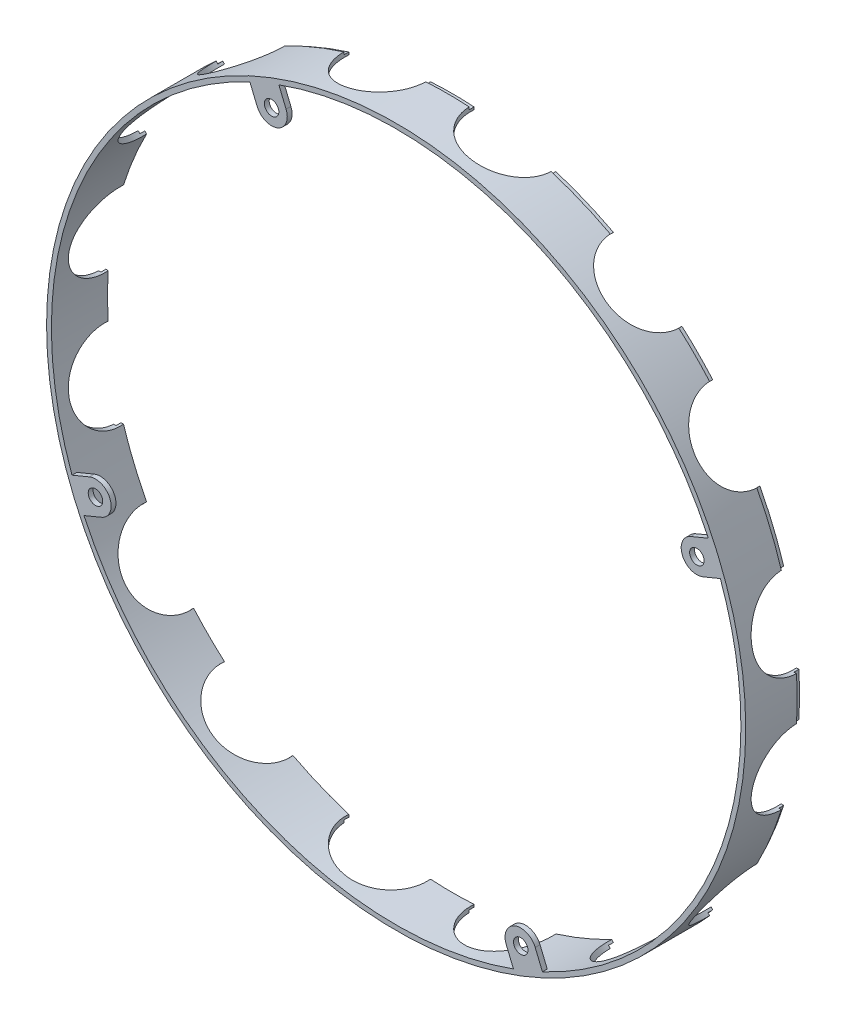
from build123d import *

# Parameters (mm, degrees)
SKIZZE4_R                       = 72.5
SKIZZE4_R_2                     = 72
BASE_RING_DEPTH                 = 9.65
SKIZZE6_R                       = 72
SKIZZE6_R_2                     = 71.5
INNER_RING_DEPTH                = 10.65
UPPER_START                     = 1
SKIZZE9_R                       = 72.5
SKIZZE9_R_2                     = 71.5
UPPER_RING_DEPTH                = 1
SKIZZE5_R                       = 8.5
SENSOR_CUT_DEPTH                = 104.082115326
SENSOR_ROTATION_COUNT           = 8
AUFSATZ_LINEAR_START            = 1
SKIZZE8_R                       = 1.5
AUFSATZ_LINEAR_AUSTRAGEN3_DEPTH = 1
KREISMUSTER2_COUNT              = 4


with BuildPart() as part:
    # Skizze4 → Base Ring (new body)
    with BuildSketch(Plane.XY):
        Circle(SKIZZE4_R)
        Circle(SKIZZE4_R_2, mode=Mode.SUBTRACT)
    extrude(amount=-BASE_RING_DEPTH)

    # Skizze6 → Inner Ring (add)
    with BuildSketch(Plane.XY):
        Circle(SKIZZE6_R)
        Circle(SKIZZE6_R_2, mode=Mode.SUBTRACT)
    extrude(amount=-INNER_RING_DEPTH)

    # Skizze9 → Upper Ring (add)
    with BuildSketch(Plane.XY.offset(UPPER_START)):
        Circle(SKIZZE9_R)
        Circle(SKIZZE9_R_2, mode=Mode.SUBTRACT)
    extrude(amount=-UPPER_RING_DEPTH)

    # Skizze5 → Sensor Cut (cut, through all)
    with BuildSketch(Plane(origin=(0, 0, 0), x_dir=(1, 0, 0), z_dir=(0, 1, 0))):
        with Locations((-13, 9.95)):
            Circle(SKIZZE5_R)
        with Locations((13, 9.95)):
            Circle(SKIZZE5_R)
    sensor_cut = extrude(amount=SENSOR_CUT_DEPTH, mode=Mode.SUBTRACT)

    # Sensor Rotation: Sensor Cut ×8 about axis
    sensor_rotation_axis = Axis((0, 0, -215.296752982), (0, 0, 1))
    for i in range(1, SENSOR_ROTATION_COUNT):
        add(sensor_cut.rotate(sensor_rotation_axis, i * 360 / SENSOR_ROTATION_COUNT), mode=Mode.SUBTRACT)

    # Skizze8 → Aufsatz-Linear austragen3 (add)
    # profile 1 of 2: a face of its own
    with BuildSketch(Plane.XY.offset(AUFSATZ_LINEAR_START)):
        with BuildLine():
            Line((64.745389033, 30.336192889), (67.232831343, 24.330975928))
            ThreePointArc((67.232831343, 24.330975928), (66.057386575, 27.361865414), (64.745389033, 30.336192889))
        make_face()
    # profile 2 of 2: a face of its own
    with BuildSketch(Plane.XY.offset(AUFSATZ_LINEAR_START)):
        with BuildLine():
            Line((64.745389033, 30.336192889), (61.118147289, 28.833740165))
            ThreePointArc((61.118147289, 28.833740165), (59.359259964, 24.587410529), (63.6055896, 22.828523204))
            Line((63.6055896, 22.828523204), (67.232831343, 24.330975928))
            Line((67.232831343, 24.330975928), (64.745389033, 30.336192889))
        make_face()
        with Locations((62.361868445, 25.831131685)):
            Circle(SKIZZE8_R, mode=Mode.SUBTRACT)
    aufsatz_linear_austragen3 = extrude(amount=-AUFSATZ_LINEAR_AUSTRAGEN3_DEPTH)

    # Kreismuster2: Aufsatz-Linear austragen3 ×4 about axis
    kreismuster2_axis = Axis((0, 0, 0), (0, 0, 1))
    for i in range(1, KREISMUSTER2_COUNT):
        add(aufsatz_linear_austragen3.rotate(kreismuster2_axis, i * 360 / KREISMUSTER2_COUNT))


solid = part.part
